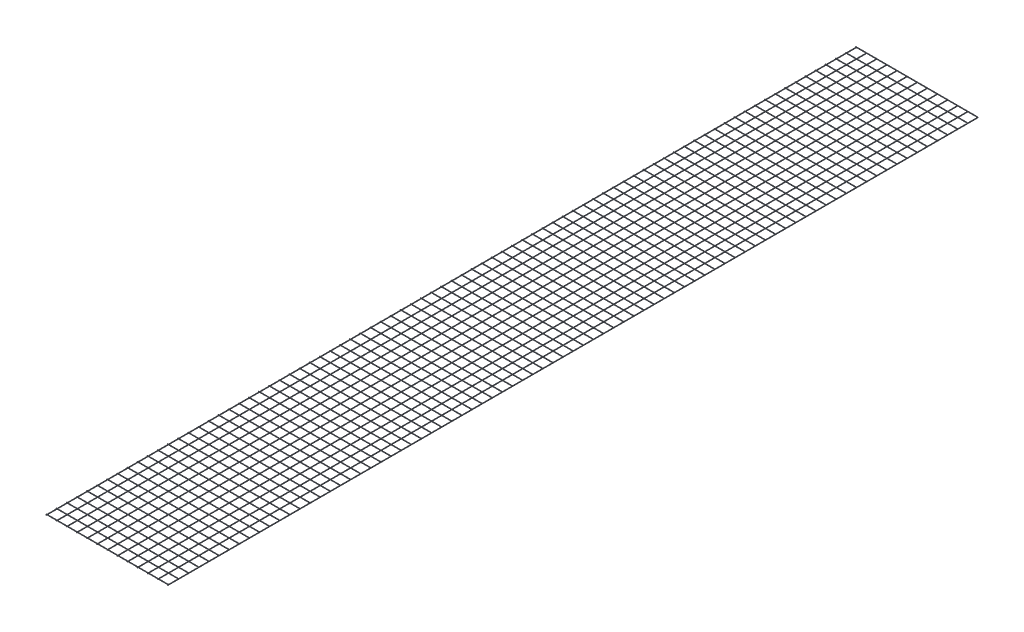
from build123d import *

# Parameters (mm, degrees)
SKETCH1_R              = 2.5
BOSS_EXTRUDE2_DEPTH    = 8000
BOSS_EXTRUDE2_2_DEPTH  = 8000
BOSS_EXTRUDE2_3_DEPTH  = 8000
BOSS_EXTRUDE2_4_DEPTH  = 8000
BOSS_EXTRUDE2_5_DEPTH  = 8000
BOSS_EXTRUDE2_6_DEPTH  = 8000
BOSS_EXTRUDE2_7_DEPTH  = 8000
BOSS_EXTRUDE2_8_DEPTH  = 8000
BOSS_EXTRUDE2_9_DEPTH  = 8000
BOSS_EXTRUDE2_10_DEPTH = 8000
BOSS_EXTRUDE2_11_DEPTH = 8000
BOSS_EXTRUDE2_12_DEPTH = 8000
BOSS_EXTRUDE2_13_DEPTH = 8000
SKETCH2_R              = 2.5
BOSS_EXTRUDE3_DEPTH    = 1205


with BuildPart() as part:
    # Sketch1 → Boss-Extrude2 (new body)
    with BuildSketch(Plane.XY):
        with Locations((-77.238499913, 0)):
            Circle(SKETCH1_R)
    extrude(amount=BOSS_EXTRUDE2_DEPTH)


with BuildPart() as body_2:
    # Sketch1 → Boss-Extrude2 2 (new body)
    with BuildSketch(Plane.XY):
        with Locations((22.761500087, 0)):
            Circle(SKETCH1_R)
    extrude(amount=BOSS_EXTRUDE2_2_DEPTH)


with BuildPart() as body_3:
    # Sketch1 → Boss-Extrude2 3 (new body)
    with BuildSketch(Plane.XY):
        with Locations((122.761500087, 0)):
            Circle(SKETCH1_R)
    extrude(amount=BOSS_EXTRUDE2_3_DEPTH)


with BuildPart() as body_4:
    # Sketch1 → Boss-Extrude2 4 (new body)
    with BuildSketch(Plane.XY):
        with Locations((222.761500087, 0)):
            Circle(SKETCH1_R)
    extrude(amount=BOSS_EXTRUDE2_4_DEPTH)


with BuildPart() as body_5:
    # Sketch1 → Boss-Extrude2 5 (new body)
    with BuildSketch(Plane.XY):
        with Locations((322.761500087, 0)):
            Circle(SKETCH1_R)
    extrude(amount=BOSS_EXTRUDE2_5_DEPTH)


with BuildPart() as body_6:
    # Sketch1 → Boss-Extrude2 6 (new body)
    with BuildSketch(Plane.XY):
        with Locations((422.761500087, 0)):
            Circle(SKETCH1_R)
    extrude(amount=BOSS_EXTRUDE2_6_DEPTH)


with BuildPart() as body_7:
    # Sketch1 → Boss-Extrude2 7 (new body)
    with BuildSketch(Plane.XY):
        with Locations((522.761500087, 0)):
            Circle(SKETCH1_R)
    extrude(amount=BOSS_EXTRUDE2_7_DEPTH)


with BuildPart() as body_8:
    # Sketch1 → Boss-Extrude2 8 (new body)
    with BuildSketch(Plane.XY):
        with Locations((622.761500087, 0)):
            Circle(SKETCH1_R)
    extrude(amount=BOSS_EXTRUDE2_8_DEPTH)


with BuildPart() as body_9:
    # Sketch1 → Boss-Extrude2 9 (new body)
    with BuildSketch(Plane.XY):
        with Locations((722.761500087, 0)):
            Circle(SKETCH1_R)
    extrude(amount=BOSS_EXTRUDE2_9_DEPTH)


with BuildPart() as body_10:
    # Sketch1 → Boss-Extrude2 10 (new body)
    with BuildSketch(Plane.XY):
        with Locations((822.761500087, 0)):
            Circle(SKETCH1_R)
    extrude(amount=BOSS_EXTRUDE2_10_DEPTH)


with BuildPart() as body_11:
    # Sketch1 → Boss-Extrude2 11 (new body)
    with BuildSketch(Plane.XY):
        with Locations((922.761500087, 0)):
            Circle(SKETCH1_R)
    extrude(amount=BOSS_EXTRUDE2_11_DEPTH)


with BuildPart() as body_12:
    # Sketch1 → Boss-Extrude2 12 (new body)
    with BuildSketch(Plane.XY):
        with Locations((1022.761500087, 0)):
            Circle(SKETCH1_R)
    extrude(amount=BOSS_EXTRUDE2_12_DEPTH)


with BuildPart() as body_13:
    # Sketch1 → Boss-Extrude2 13 (new body)
    with BuildSketch(Plane.XY):
        with Locations((1122.761500087, 0)):
            Circle(SKETCH1_R)
    extrude(amount=BOSS_EXTRUDE2_13_DEPTH)


with BuildPart() as body_14:
    # Sketch2 → Boss-Extrude3 (new body)
    with BuildSketch(Plane.ZY.offset(79.738499913)):
        with Locations((2.5, 5)):
            Circle(SKETCH2_R)
        with Locations((102.44, 5)):
            Circle(SKETCH2_R)
        with Locations((202.38, 5)):
            Circle(SKETCH2_R)
        with Locations((302.32, 5)):
            Circle(SKETCH2_R)
        with Locations((402.26, 5)):
            Circle(SKETCH2_R)
        with Locations((502.2, 5)):
            Circle(SKETCH2_R)
        with Locations((602.14, 5)):
            Circle(SKETCH2_R)
        with Locations((702.08, 5)):
            Circle(SKETCH2_R)
        with Locations((802.02, 5)):
            Circle(SKETCH2_R)
        with Locations((901.96, 5)):
            Circle(SKETCH2_R)
        with Locations((1001.9, 5)):
            Circle(SKETCH2_R)
        with Locations((1101.84, 5)):
            Circle(SKETCH2_R)
        with Locations((1201.78, 5)):
            Circle(SKETCH2_R)
        with Locations((1301.72, 5)):
            Circle(SKETCH2_R)
        with Locations((1401.66, 5)):
            Circle(SKETCH2_R)
        with Locations((1501.6, 5)):
            Circle(SKETCH2_R)
        with Locations((1601.54, 5)):
            Circle(SKETCH2_R)
        with Locations((1701.48, 5)):
            Circle(SKETCH2_R)
        with Locations((1801.42, 5)):
            Circle(SKETCH2_R)
        with Locations((1901.36, 5)):
            Circle(SKETCH2_R)
        with Locations((2001.3, 5)):
            Circle(SKETCH2_R)
        with Locations((2101.24, 5)):
            Circle(SKETCH2_R)
        with Locations((2201.18, 5)):
            Circle(SKETCH2_R)
        with Locations((2301.12, 5)):
            Circle(SKETCH2_R)
        with Locations((2401.06, 5)):
            Circle(SKETCH2_R)
        with Locations((2501, 5)):
            Circle(SKETCH2_R)
        with Locations((2600.94, 5)):
            Circle(SKETCH2_R)
        with Locations((2700.88, 5)):
            Circle(SKETCH2_R)
        with Locations((2800.82, 5)):
            Circle(SKETCH2_R)
        with Locations((2900.76, 5)):
            Circle(SKETCH2_R)
        with Locations((3000.7, 5)):
            Circle(SKETCH2_R)
        with Locations((3100.64, 5)):
            Circle(SKETCH2_R)
        with Locations((3200.58, 5)):
            Circle(SKETCH2_R)
        with Locations((3300.52, 5)):
            Circle(SKETCH2_R)
        with Locations((3400.46, 5)):
            Circle(SKETCH2_R)
        with Locations((3500.4, 5)):
            Circle(SKETCH2_R)
        with Locations((3600.34, 5)):
            Circle(SKETCH2_R)
        with Locations((3700.28, 5)):
            Circle(SKETCH2_R)
        with Locations((3800.22, 5)):
            Circle(SKETCH2_R)
        with Locations((3900.16, 5)):
            Circle(SKETCH2_R)
        with Locations((4000.1, 5)):
            Circle(SKETCH2_R)
        with Locations((4100.04, 5)):
            Circle(SKETCH2_R)
        with Locations((4199.98, 5)):
            Circle(SKETCH2_R)
        with Locations((4299.92, 5)):
            Circle(SKETCH2_R)
        with Locations((4399.86, 5)):
            Circle(SKETCH2_R)
        with Locations((4499.8, 5)):
            Circle(SKETCH2_R)
        with Locations((4599.74, 5)):
            Circle(SKETCH2_R)
        with Locations((4699.68, 5)):
            Circle(SKETCH2_R)
        with Locations((4799.62, 5)):
            Circle(SKETCH2_R)
        with Locations((4899.56, 5)):
            Circle(SKETCH2_R)
        with Locations((4999.5, 5)):
            Circle(SKETCH2_R)
        with Locations((5099.44, 5)):
            Circle(SKETCH2_R)
        with Locations((5199.38, 5)):
            Circle(SKETCH2_R)
        with Locations((5299.32, 5)):
            Circle(SKETCH2_R)
        with Locations((5399.26, 5)):
            Circle(SKETCH2_R)
        with Locations((5499.2, 5)):
            Circle(SKETCH2_R)
        with Locations((5599.14, 5)):
            Circle(SKETCH2_R)
        with Locations((5699.08, 5)):
            Circle(SKETCH2_R)
        with Locations((5799.02, 5)):
            Circle(SKETCH2_R)
        with Locations((5898.96, 5)):
            Circle(SKETCH2_R)
        with Locations((5998.9, 5)):
            Circle(SKETCH2_R)
        with Locations((6098.84, 5)):
            Circle(SKETCH2_R)
        with Locations((6198.78, 5)):
            Circle(SKETCH2_R)
        with Locations((6298.72, 5)):
            Circle(SKETCH2_R)
        with Locations((6398.66, 5)):
            Circle(SKETCH2_R)
        with Locations((6498.6, 5)):
            Circle(SKETCH2_R)
        with Locations((6598.54, 5)):
            Circle(SKETCH2_R)
        with Locations((6698.48, 5)):
            Circle(SKETCH2_R)
        with Locations((6798.42, 5)):
            Circle(SKETCH2_R)
        with Locations((6898.36, 5)):
            Circle(SKETCH2_R)
        with Locations((6998.3, 5)):
            Circle(SKETCH2_R)
        with Locations((7098.24, 5)):
            Circle(SKETCH2_R)
        with Locations((7198.18, 5)):
            Circle(SKETCH2_R)
        with Locations((7298.12, 5)):
            Circle(SKETCH2_R)
        with Locations((7398.06, 5)):
            Circle(SKETCH2_R)
        with Locations((7498, 5)):
            Circle(SKETCH2_R)
        with Locations((7597.94, 5)):
            Circle(SKETCH2_R)
        with Locations((7697.88, 5)):
            Circle(SKETCH2_R)
        with Locations((7797.82, 5)):
            Circle(SKETCH2_R)
        with Locations((7897.76, 5)):
            Circle(SKETCH2_R)
        with Locations((7997.7, 5)):
            Circle(SKETCH2_R)
    extrude(amount=-BOSS_EXTRUDE3_DEPTH)


solid = Compound([part.part, body_2.part, body_3.part, body_4.part, body_5.part, body_6.part, body_7.part, body_8.part, body_9.part, body_10.part, body_11.part, body_12.part, body_13.part, body_14.part])
